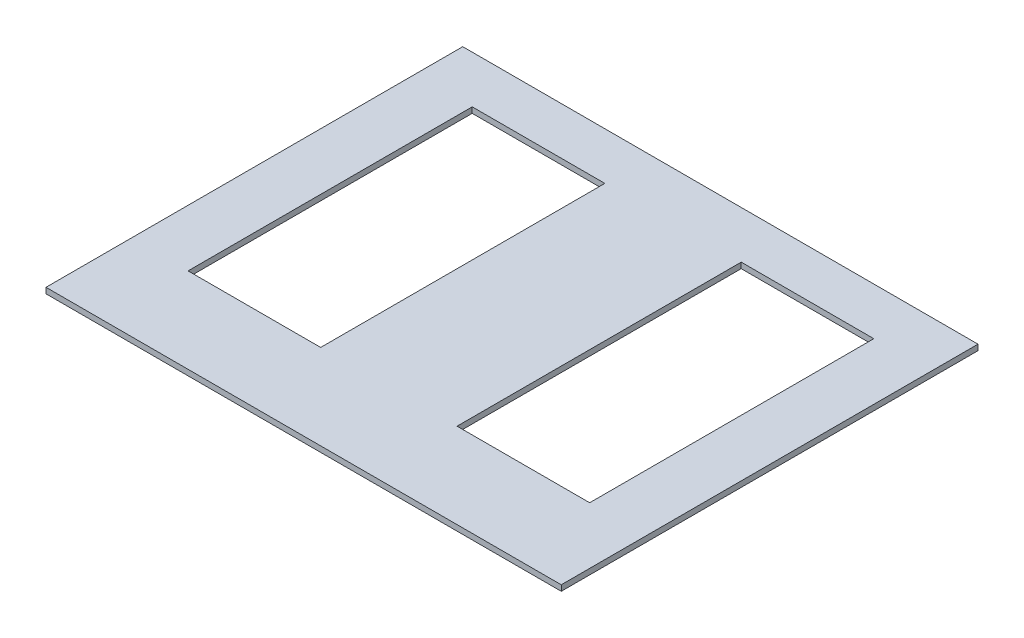
from build123d import *

# Parameters (mm, degrees)
SKETCH1_W           = 272
SKETCH1_H           = 220
BOSS_EXTRUDE1_DEPTH = 3
SKETCH2_W           = 70
SKETCH2_H           = 150
CUT_EXTRUDE1_DEPTH  = 175.94284781


with BuildPart() as part:
    # Sketch1 → Boss-Extrude1 (new body)
    with BuildSketch(Plane(origin=(0, 0, 0), x_dir=(1, 0, 0), z_dir=(0, 1, 0))):
        Rectangle(SKETCH1_W, SKETCH1_H)
    extrude(amount=BOSS_EXTRUDE1_DEPTH)

    # Sketch2 → Cut-Extrude1 (cut, through all)
    with BuildSketch(Plane(origin=(0, 3, 0), x_dir=(1, 0, 0), z_dir=(0, 1, 0))):
        with Locations((-71, 10)):
            Rectangle(SKETCH2_W, SKETCH2_H)
        with Locations((71, 10)):
            Rectangle(SKETCH2_W, SKETCH2_H)
    extrude(amount=-CUT_EXTRUDE1_DEPTH, mode=Mode.SUBTRACT)


solid = part.part
